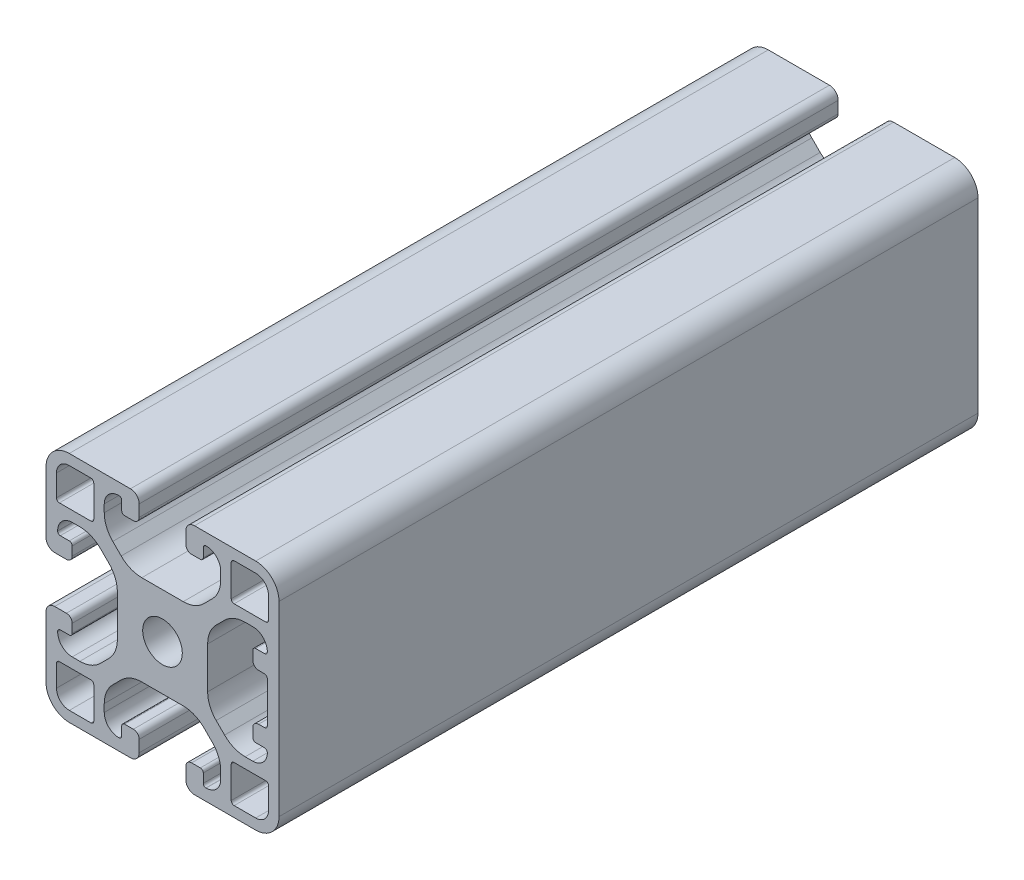
from build123d import *

# Parameters (mm, degrees)
SCHIZZO1_R                   = 3.4
ESTRUSIONE_ESTRUSIONE1_DEPTH = 120


with BuildPart() as part:
    # Schizzo1 → Estrusione-Estrusione1 (new body)
    with BuildSketch(Plane(origin=(0, 0, -340), x_dir=(-1, 0, 0), z_dir=(0, 0, -1))):
        with BuildLine():
            Line((6.5, -15.5), (5, -15.5))
            ThreePointArc((5, -15.5), (4.292893219, -15.792893219), (4, -16.5))
            Line((4, -16.5), (4, -18.5))
            ThreePointArc((4, -18.5), (4.439339828, -19.560660172), (5.5, -20))
            Line((5.5, -20), (16, -20))
            ThreePointArc((16, -20), (18.828427125, -18.828427125), (20, -16))
            Line((20, -16), (20, -5.5))
            ThreePointArc((20, -5.5), (19.560660172, -4.439339828), (18.5, -4))
            Line((18.5, -4), (16.5, -4))
            ThreePointArc((16.5, -4), (15.792893219, -4.292893219), (15.5, -5))
            Line((15.5, -5), (15.5, -6.5))
            ThreePointArc((15.5, -6.5), (15.646446609, -6.853553391), (16, -7))
            Line((16, -7), (17.55, -7))
            ThreePointArc((17.55, -7), (17.868198052, -7.131801948), (18, -7.45))
            Line((18, -7.45), (18, -7.5))
            ThreePointArc((18, -7.5), (17.267766953, -9.267766953), (15.5, -10))
            Line((15.5, -10), (14.192388155, -10))
            ThreePointArc((14.192388155, -10), (12.278970994, -9.619397663), (10.656854249, -8.535533906))
            Line((10.656854249, -8.535533906), (9.214466094, -7.09314575))
            ThreePointArc((9.214466094, -7.09314575), (8.130602337, -5.471029006), (7.75, -3.557611845))
            Line((7.75, -3.557611845), (7.75, 3.557611845))
            ThreePointArc((7.75, 3.557611845), (8.130602337, 5.471029006), (9.214466094, 7.09314575))
            Line((9.214466094, 7.09314575), (10.656854249, 8.535533906))
            ThreePointArc((10.656854249, 8.535533906), (12.278970994, 9.619397663), (14.192388155, 10))
            Line((14.192388155, 10), (15.5, 10))
            ThreePointArc((15.5, 10), (17.267766953, 9.267766953), (18, 7.5))
            Line((18, 7.5), (18, 7.45))
            ThreePointArc((18, 7.45), (17.868198052, 7.131801948), (17.55, 7))
            Line((17.55, 7), (16, 7))
            ThreePointArc((16, 7), (15.646446609, 6.853553391), (15.5, 6.5))
            Line((15.5, 6.5), (15.5, 5))
            ThreePointArc((15.5, 5), (15.792893219, 4.292893219), (16.5, 4))
            Line((16.5, 4), (18.5, 4))
            ThreePointArc((18.5, 4), (19.560660172, 4.439339828), (20, 5.5))
            Line((20, 5.5), (20, 16))
            ThreePointArc((20, 16), (18.828427125, 18.828427125), (16, 20))
            Line((16, 20), (5.5, 20))
            ThreePointArc((5.5, 20), (4.439339828, 19.560660172), (4, 18.5))
            Line((4, 18.5), (4, 16.5))
            ThreePointArc((4, 16.5), (4.292893219, 15.792893219), (5, 15.5))
            Line((5, 15.5), (6.5, 15.5))
            ThreePointArc((6.5, 15.5), (6.853553391, 15.646446609), (7, 16))
            Line((7, 16), (7, 17.55))
            ThreePointArc((7, 17.55), (7.131801948, 17.868198052), (7.45, 18))
            Line((7.45, 18), (7.5, 18))
            ThreePointArc((7.5, 18), (9.267766953, 17.267766953), (10, 15.5))
            Line((10, 15.5), (10, 14.192388155))
            ThreePointArc((10, 14.192388155), (9.619397663, 12.278970994), (8.535533906, 10.656854249))
            Line((8.535533906, 10.656854249), (7.09314575, 9.214466094))
            ThreePointArc((7.09314575, 9.214466094), (5.471029006, 8.130602337), (3.557611844, 7.75))
            Line((3.557611844, 7.75), (-3.557611845, 7.75))
            ThreePointArc((-3.557611845, 7.75), (-5.471029006, 8.130602337), (-7.09314575, 9.214466094))
            Line((-7.09314575, 9.214466094), (-8.535533906, 10.656854249))
            ThreePointArc((-8.535533906, 10.656854249), (-9.619397663, 12.278970994), (-10, 14.192388155))
            Line((-10, 14.192388155), (-10, 15.5))
            ThreePointArc((-10, 15.5), (-9.267766953, 17.267766953), (-7.5, 18))
            Line((-7.5, 18), (-7.45, 18))
            ThreePointArc((-7.45, 18), (-7.131801948, 17.868198052), (-7, 17.55))
            Line((-7, 17.55), (-7, 16))
            ThreePointArc((-7, 16), (-6.853553391, 15.646446609), (-6.5, 15.5))
            Line((-6.5, 15.5), (-5, 15.5))
            ThreePointArc((-5, 15.5), (-4.292893219, 15.792893219), (-4, 16.5))
            Line((-4, 16.5), (-4, 18.5))
            ThreePointArc((-4, 18.5), (-4.439339828, 19.560660172), (-5.5, 20))
            Line((-5.5, 20), (-16, 20))
            ThreePointArc((-16, 20), (-18.828427125, 18.828427125), (-20, 16))
            Line((-20, 16), (-20, -16))
            ThreePointArc((-20, -16), (-18.828427125, -18.828427125), (-16, -20))
            Line((-16, -20), (-5.5, -20))
            ThreePointArc((-5.5, -20), (-4.439339828, -19.560660172), (-4, -18.5))
            Line((-4, -18.5), (-4, -16.5))
            ThreePointArc((-4, -16.5), (-4.292893219, -15.792893219), (-5, -15.5))
            Line((-5, -15.5), (-6.5, -15.5))
            ThreePointArc((-6.5, -15.5), (-6.853553391, -15.646446609), (-7, -16))
            Line((-7, -16), (-7, -17.55))
            ThreePointArc((-7, -17.55), (-7.131801948, -17.868198052), (-7.45, -18))
            Line((-7.45, -18), (-7.5, -18))
            ThreePointArc((-7.5, -18), (-9.267766953, -17.267766953), (-10, -15.5))
            Line((-10, -15.5), (-10, -14.192388155))
            ThreePointArc((-10, -14.192388155), (-9.619397663, -12.278970994), (-8.535533906, -10.656854249))
            Line((-8.535533906, -10.656854249), (-7.09314575, -9.214466094))
            ThreePointArc((-7.09314575, -9.214466094), (-5.471029006, -8.130602337), (-3.557611845, -7.75))
            Line((-3.557611845, -7.75), (3.557611845, -7.75))
            ThreePointArc((3.557611845, -7.75), (5.471029006, -8.130602337), (7.09314575, -9.214466094))
            Line((7.09314575, -9.214466094), (8.535533906, -10.656854249))
            ThreePointArc((8.535533906, -10.656854249), (9.619397663, -12.278970994), (10, -14.192388155))
            Line((10, -14.192388155), (10, -15.5))
            ThreePointArc((10, -15.5), (9.267766953, -17.267766953), (7.5, -18))
            Line((7.5, -18), (7.45, -18))
            ThreePointArc((7.45, -18), (7.131801948, -17.868198052), (7, -17.55))
            Line((7, -17.55), (7, -16))
            ThreePointArc((7, -16), (6.853553391, -15.646446609), (6.5, -15.5))
        make_face()
        with Locations(Location((0, 0, 0), (0, 0, 180))):
            Circle(SCHIZZO1_R, mode=Mode.SUBTRACT)
        with BuildLine():
            Line((-12.3, -18.2), (-16, -18.2))
            ThreePointArc((-16, -18.2), (-17.555634919, -17.555634919), (-18.2, -16))
            Line((-18.2, -16), (-18.2, -12.3))
            ThreePointArc((-18.2, -12.3), (-18.053553391, -11.946446609), (-17.7, -11.8))
            Line((-17.7, -11.8), (-12.3, -11.8))
            ThreePointArc((-12.3, -11.8), (-11.946446609, -11.946446609), (-11.8, -12.3))
            Line((-11.8, -12.3), (-11.8, -17.7))
            ThreePointArc((-11.8, -17.7), (-11.946446609, -18.053553391), (-12.3, -18.2))
        make_face(mode=Mode.SUBTRACT)
        with BuildLine():
            Line((-11.8, 17.7), (-11.8, 12.3))
            ThreePointArc((-11.8, 12.3), (-11.946446609, 11.946446609), (-12.3, 11.8))
            Line((-12.3, 11.8), (-17.7, 11.8))
            ThreePointArc((-17.7, 11.8), (-18.053553391, 11.946446609), (-18.2, 12.3))
            Line((-18.2, 12.3), (-18.2, 16))
            ThreePointArc((-18.2, 16), (-17.555634919, 17.555634919), (-16, 18.2))
            Line((-16, 18.2), (-12.3, 18.2))
            ThreePointArc((-12.3, 18.2), (-11.946446609, 18.053553391), (-11.8, 17.7))
        make_face(mode=Mode.SUBTRACT)
        with BuildLine():
            Line((18.2, 16), (18.2, 12.3))
            ThreePointArc((18.2, 12.3), (18.053553391, 11.946446609), (17.7, 11.8))
            Line((17.7, 11.8), (12.3, 11.8))
            ThreePointArc((12.3, 11.8), (11.946446609, 11.946446609), (11.8, 12.3))
            Line((11.8, 12.3), (11.8, 17.7))
            ThreePointArc((11.8, 17.7), (11.946446609, 18.053553391), (12.3, 18.2))
            Line((12.3, 18.2), (16, 18.2))
            ThreePointArc((16, 18.2), (17.555634919, 17.555634919), (18.2, 16))
        make_face(mode=Mode.SUBTRACT)
        with BuildLine():
            Line((18.2, -12.3), (18.2, -16))
            ThreePointArc((18.2, -16), (17.555634919, -17.555634919), (16, -18.2))
            Line((16, -18.2), (12.3, -18.2))
            ThreePointArc((12.3, -18.2), (11.946446609, -18.053553391), (11.8, -17.7))
            Line((11.8, -17.7), (11.8, -12.3))
            ThreePointArc((11.8, -12.3), (11.946446609, -11.946446609), (12.3, -11.8))
            Line((12.3, -11.8), (17.7, -11.8))
            ThreePointArc((17.7, -11.8), (18.053553391, -11.946446609), (18.2, -12.3))
        make_face(mode=Mode.SUBTRACT)
        with BuildLine():
            Line((-16, 7), (-17.5, 7))
            ThreePointArc((-17.5, 7), (-17.853553391, 7.146446609), (-18, 7.5))
            ThreePointArc((-18, 7.5), (-17.267766953, 9.267766953), (-15.5, 10))
            Line((-15.5, 10), (-14.192388155, 10))
            ThreePointArc((-14.192388155, 10), (-12.278970994, 9.619397663), (-10.656854249, 8.535533906))
            Line((-10.656854249, 8.535533906), (-9.214466094, 7.093145751))
            ThreePointArc((-9.214466094, 7.093145751), (-8.130602337, 5.471029006), (-7.75, 3.557611845))
            Line((-7.75, 3.557611845), (-7.75, -3.557611845))
            ThreePointArc((-7.75, -3.557611845), (-8.130602337, -5.471029006), (-9.214466094, -7.093145751))
            Line((-9.214466094, -7.093145751), (-10.656854249, -8.535533906))
            ThreePointArc((-10.656854249, -8.535533906), (-12.278970994, -9.619397663), (-14.192388155, -10))
            Line((-14.192388155, -10), (-15.5, -10))
            ThreePointArc((-15.5, -10), (-17.267766953, -9.267766953), (-18, -7.5))
            ThreePointArc((-18, -7.5), (-17.853553391, -7.146446609), (-17.5, -7))
            Line((-17.5, -7), (-16, -7))
            ThreePointArc((-16, -7), (-15.646446609, -6.853553391), (-15.5, -6.5))
            Line((-15.5, -6.5), (-15.5, -5))
            ThreePointArc((-15.5, -5), (-15.792893219, -4.292893219), (-16.5, -4))
            Line((-16.5, -4), (-17.5, -4))
            ThreePointArc((-17.5, -4), (-17.853553391, -3.853553391), (-18, -3.5))
            Line((-18, -3.5), (-18, 3.5))
            ThreePointArc((-18, 3.5), (-17.853553391, 3.853553391), (-17.5, 4))
            Line((-17.5, 4), (-16.5, 4))
            ThreePointArc((-16.5, 4), (-15.792893219, 4.292893219), (-15.5, 5))
            Line((-15.5, 5), (-15.5, 6.5))
            ThreePointArc((-15.5, 6.5), (-15.646446609, 6.853553391), (-16, 7))
        make_face(mode=Mode.SUBTRACT)
    extrude(amount=-ESTRUSIONE_ESTRUSIONE1_DEPTH)


solid = part.part
